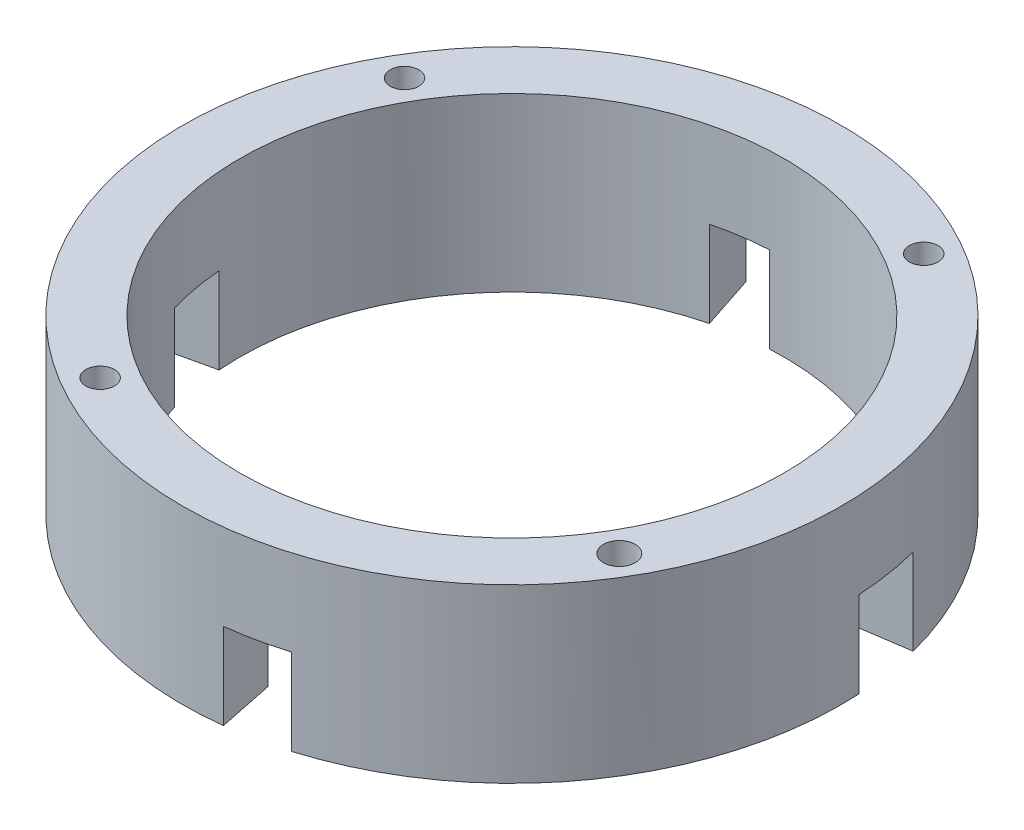
from build123d import *

# Parameters (mm, degrees)
ESQUISSE1_R             = 57.5
ESQUISSE1_R_2           = 47.5
BOSS_EXTRU_3_DEPTH      = 30
ENL_V_MAT_EXTRU_4_DEPTH = 15
ENL_V_MAT_EXTRU_5_DEPTH = 15
ENL_V_MAT_EXTRU_6_DEPTH = 15
ENL_V_MAT_EXTRU_7_DEPTH = 15
ESQUISSE10_R            = 2.776949087
ESQUISSE10_R_2          = 2.5
ENL_V_MAT_EXTRU_8_DEPTH = 10


with BuildPart() as part:
    # Esquisse1 → Boss.-Extru.3 (new body)
    with BuildSketch(Plane(origin=(0, 0, 0), x_dir=(1, 0, 0), z_dir=(0, 1, 0))):
        with Locations(Location((0, 0, 0), (0, 0, 270))):
            Circle(ESQUISSE1_R)
        with Locations(Location((0, 0, 0), (0, 0, 270))):
            Circle(ESQUISSE1_R_2, mode=Mode.SUBTRACT)
    extrude(amount=BOSS_EXTRU_3_DEPTH)

    # Esquisse4 → Enlèv. mat.-Extru.4 (cut)
    with BuildSketch(Plane(origin=(0, 0, 0), x_dir=(-1, 0, 0), z_dir=(0, -1, 0))):
        Polygon((-4.740706844, -47.262836337), (-14.579980258, -45.207014673), (-17.999133934, -61.771502914), (-8.15986052, -63.827324578), align=None)
    extrude(amount=-ENL_V_MAT_EXTRU_4_DEPTH, mode=Mode.SUBTRACT)

    # Esquisse6 → Enlèv. mat.-Extru.5 (cut)
    with BuildSketch(Plane(origin=(0, 0, 0), x_dir=(-1, 0, 0), z_dir=(0, -1, 0))):
        Polygon((37.97805027, -11.470285743), (58.779258548, -16.171123772), (59.719426153, -6.534405813), (38.918217876, -1.833567784), align=None)
    extrude(amount=-ENL_V_MAT_EXTRU_5_DEPTH, mode=Mode.SUBTRACT)

    # Esquisse7 → Enlèv. mat.-Extru.6 (cut)
    with BuildSketch(Plane(origin=(0, 0, 0), x_dir=(-1, 0, 0), z_dir=(0, -1, 0))):
        Polygon((10.091528645, 41.476841185), (15.939537835, 59.219106356), (6.91972705, 60.755447754), (1.071717859, 43.013182582), align=None)
    extrude(amount=-ENL_V_MAT_EXTRU_6_DEPTH, mode=Mode.SUBTRACT)

    # Esquisse8 → Enlèv. mat.-Extru.7 (cut)
    with BuildSketch(Plane(origin=(0, 0, 0), x_dir=(-1, 0, 0), z_dir=(0, -1, 0))):
        Polygon((-42.754189526, 0.991012316), (-70.16329298, 5.019646945), (-68.868374707, 16.242271981), (-41.459271253, 12.213637353), align=None)
    extrude(amount=-ENL_V_MAT_EXTRU_7_DEPTH, mode=Mode.SUBTRACT)

    # Esquisse10 → Enlèv. mat.-Extru.8 (cut)
    with BuildSketch(Plane(origin=(0, 30, 0), x_dir=(1, 0, 0), z_dir=(0, 1, 0))):
        with Locations(Location((45.289109306, -26.55459618, 0), (0, 0, 270))):
            Circle(ESQUISSE10_R)
        with Locations(Location((26.55459618, 45.289109306, 0), (0, 0, 270))):
            Circle(ESQUISSE10_R_2)
        with Locations(Location((-26.55459618, -45.289109306, 0), (0, 0, 270))):
            Circle(ESQUISSE10_R_2)
        with Locations(Location((-45.289109306, 26.55459618, 0), (0, 0, 270))):
            Circle(ESQUISSE10_R_2)
    extrude(amount=-ENL_V_MAT_EXTRU_8_DEPTH, mode=Mode.SUBTRACT)


solid = part.part
